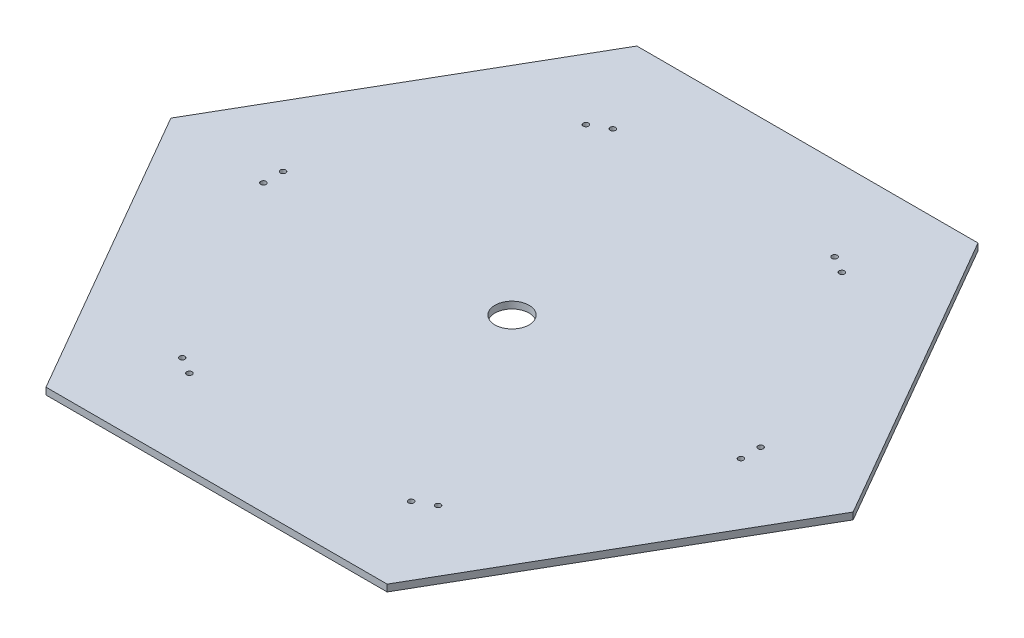
from build123d import *

# Parameters (mm, degrees)
BOSS_EXTRUDE1_DEPTH = 10
SKETCH3_R           = 3.96875
CUT_EXTRUDE1_DEPTH  = 662.513416342
SKETCH4_R           = 25
CUT_EXTRUDE2_DEPTH  = 662.513416342
CIRPATTERN2_COUNT   = 6


with BuildPart() as part:
    # Sketch1 → Boss-Extrude1 (new body)
    with BuildSketch(Plane(origin=(0, 0, 0), x_dir=(1, 0, 0), z_dir=(0, 1, 0))):
        Polygon((500, 0), (250, 433.012701892), (-250, 433.012701892), (-500, 0), (-250, -433.012701892), (250, -433.012701892), align=None)
    extrude(amount=BOSS_EXTRUDE1_DEPTH)

    # Sketch3 → Cut-Extrude1 (cut, through all)
    with BuildSketch(Plane.XZ):
        with Locations(Location((187.522727339, 295.878891325, 0), (0, 0, 270))):
            Circle(SKETCH3_R)
        with Locations(Location((162.477272661, 310.338891325, 0), (0, 0, 270))):
            Circle(SKETCH3_R)
    cut_extrude1 = extrude(amount=-CUT_EXTRUDE1_DEPTH, mode=Mode.SUBTRACT)

    # Sketch4 → Cut-Extrude2 (cut, through all)
    with BuildSketch(Plane.XZ):
        with Locations(Location((0, 0, 0), (0, 0, 270))):
            Circle(SKETCH4_R)
    extrude(amount=-CUT_EXTRUDE2_DEPTH, mode=Mode.SUBTRACT)

    # CirPattern2: Cut-Extrude1 ×6 about axis
    cirpattern2_axis = Axis((0, 0, 0), (0, 1, 0))
    for i in range(1, CIRPATTERN2_COUNT):
        add(cut_extrude1.rotate(cirpattern2_axis, i * 360 / CIRPATTERN2_COUNT), mode=Mode.SUBTRACT)


solid = part.part
